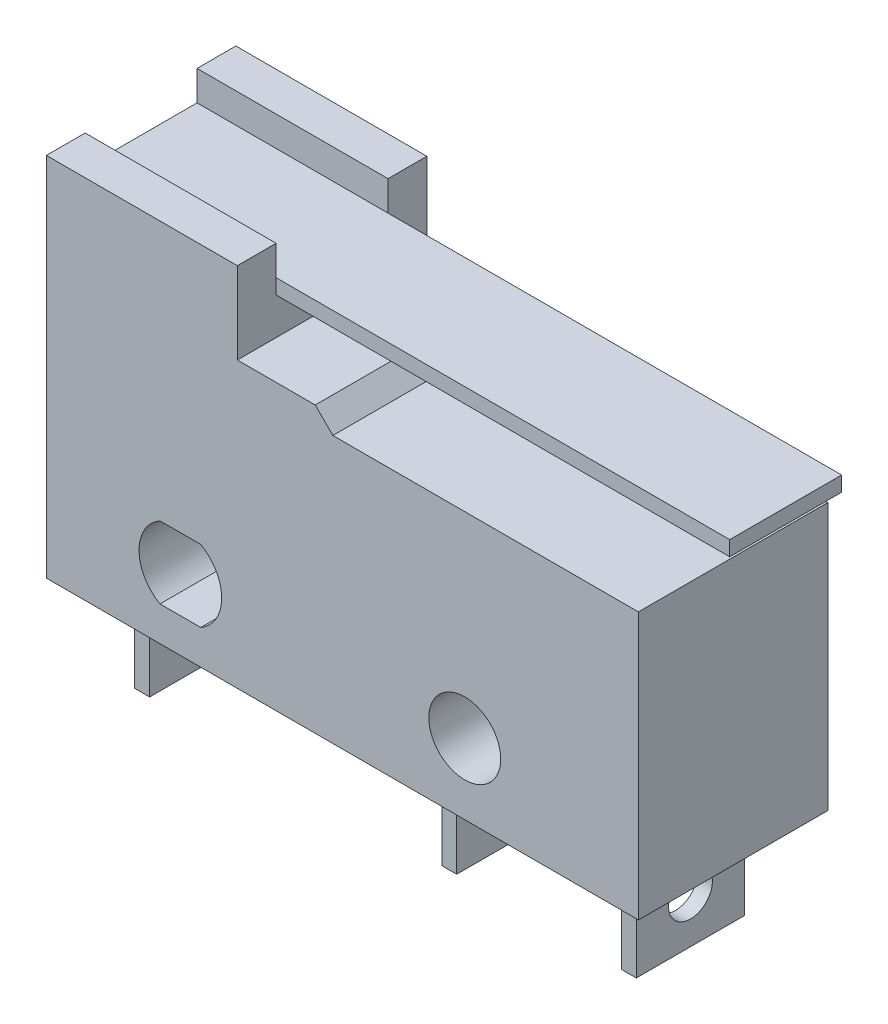
from build123d import *

# Parameters (mm, degrees)
SKETCH_1_R          = 1.205
EXTRUDE_1_DEPTH     = 3.175
SKETCH_2_W          = 0.5
SKETCH_2_H          = 3.63
EXTRUDE_2_DEPTH     = 3.08
SKETCH_3_R          = 0.735
CUT_EXTRUDE_1_DEPTH = 21.998730652
SKETCH_4_W          = 6.4
SKETCH_4_H          = 3.75
CUT_EXTRUDE_2_DEPTH = 1
SKETCH_6_W          = 21.6
SKETCH_6_H          = 3.75
EXTRUDE_3_DEPTH     = 0.5


with BuildPart() as part:
    # 스케치1 → 보스-돌출1 (new, symmetric)
    with BuildSketch(Plane.XY):
        Polygon((-14.02, -2.36), (5.82, -2.36), (5.82, 6.58), (-4.42, 6.58), (-5.01, 7.17), (-7.62, 7.17), (-7.62, 9.908), (-14.02, 9.908), (-14.02, 6.58), align=None)
        Circle(SKETCH_1_R, mode=Mode.SUBTRACT)
        with BuildLine():
            Line((-10.212788401, 1.205), (-8.847211599, 1.205))
            ThreePointArc((-8.847211599, 1.205), (-8.145, 0), (-8.847211599, -1.205))
            Line((-8.847211599, -1.205), (-10.212788401, -1.205))
            ThreePointArc((-10.212788401, -1.205), (-10.915, 0), (-10.212788401, 1.205))
        make_face(mode=Mode.SUBTRACT)
    extrude(amount=EXTRUDE_1_DEPTH, both=True)

    # 스케치2 → 보스-돌출2 (add)
    with BuildSketch(Plane.XZ.offset(2.36)):
        with Locations((-12.17, 0)):
            Rectangle(SKETCH_2_W, SKETCH_2_H)
        with Locations((-1.88, 0)):
            Rectangle(SKETCH_2_W, SKETCH_2_H)
        with Locations((4.14, 0)):
            Rectangle(SKETCH_2_W, SKETCH_2_H)
    extrude(amount=EXTRUDE_2_DEPTH)

    # 스케치3 → 컷-돌출1 (cut, through all)
    with BuildSketch(Plane.ZY.offset(12.42)):
        with Locations(Location((0, -3.9, 0), (0, 0, 270))):
            Circle(SKETCH_3_R)
    extrude(amount=-CUT_EXTRUDE_1_DEPTH, mode=Mode.SUBTRACT)

    # 스케치4 → 컷-돌출2 (cut)
    with BuildSketch(Plane(origin=(0, 9.908, 0), x_dir=(1, 0, 0), z_dir=(0, 1, 0))):
        with Locations((-10.82, 0)):
            Rectangle(SKETCH_4_W, SKETCH_4_H)
    extrude(amount=-CUT_EXTRUDE_2_DEPTH, mode=Mode.SUBTRACT)

    # 스케치6 → 보스-돌출3 (add)
    with BuildSketch(Plane(origin=(0, 8.908, 0), x_dir=(1, 0, 0), z_dir=(0, 1, 0))):
        with Locations((-3.22, 0)):
            Rectangle(SKETCH_6_W, SKETCH_6_H)
    extrude(amount=-EXTRUDE_3_DEPTH)


solid = part.part
